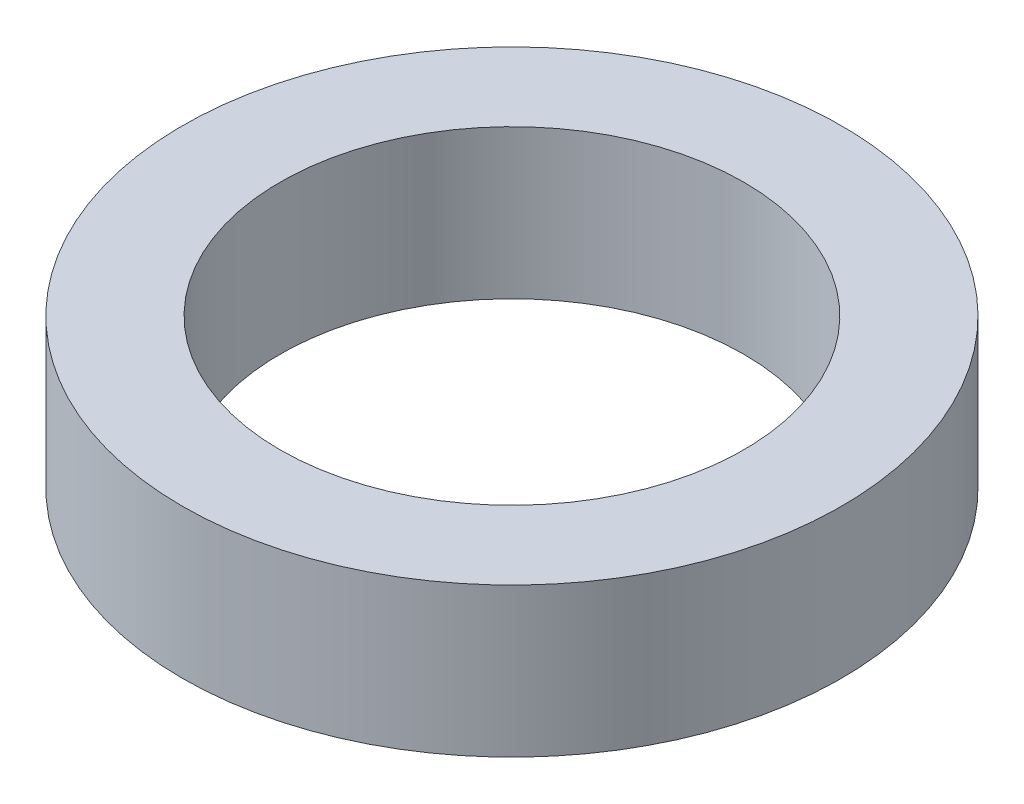
from build123d import *

# Parameters (mm, degrees)
SKETCH1_R           = 4.975
SKETCH1_R_2         = 3.5
BOSS_EXTRUDE1_DEPTH = 2.25


with BuildPart() as part:
    # Sketch1 → Boss-Extrude1 (new body)
    with BuildSketch(Plane(origin=(0, 0, 0), x_dir=(1, 0, 0), z_dir=(0, 1, 0))):
        with Locations(Location((0, 0, 0), (0, 0, 270))):
            Circle(SKETCH1_R)
        with Locations(Location((0, 0, 0), (0, 0, 270))):
            Circle(SKETCH1_R_2, mode=Mode.SUBTRACT)
    extrude(amount=BOSS_EXTRUDE1_DEPTH)


solid = part.part
